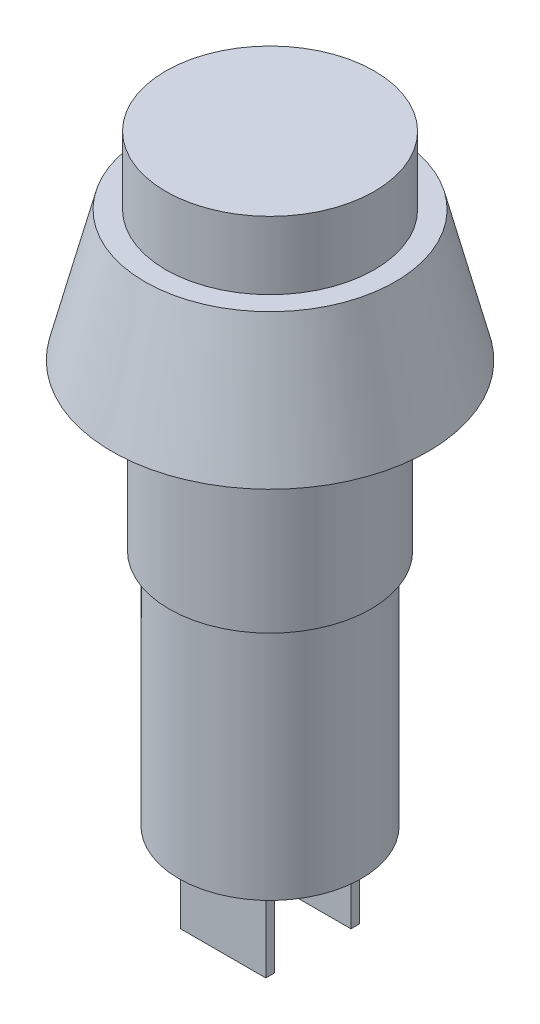
from build123d import *

# Parameters (mm, degrees)
SKETCH_6_R      = 6
EXTRUDE_3_DEPTH = 3.9
SKETCH_7_R      = 5.8
EXTRUDE_4_DEPTH = 9.5
SKETCH_8_R      = 5.25
EXTRUDE_5_DEPTH = 13.7
SKETCH_9_W      = 4.89861288
SKETCH_9_H      = 0.5003769
SKETCH_9_H_2    = 0.495607413
EXTRUDE_6_DEPTH = 5


with BuildPart() as part:
    # Эскиз5 → Повернуть1 (revolve)
    with BuildSketch(Plane.XY, mode=Mode.PRIVATE) as revolve_1_sk:
        Polygon((-7.2, 7.5), (-9.1, 0), (0, 0), (0, 7.5), align=None)
    revolve(revolve_1_sk.sketch.rotate(Axis((0, 0, 0), (0, 1, 0)), 270), axis=Axis((0, 0, 0), (0, 1, 0)))

    # Эскиз6 → Бобышка-Вытянуть3 (add)
    with BuildSketch(Plane(origin=(0, 7.5, 0), x_dir=(1, 0, 0), z_dir=(0, 1, 0))):
        with Locations(Location((0, 0, 0), (0, 0, 90))):
            Circle(SKETCH_6_R)
    extrude(amount=EXTRUDE_3_DEPTH)

    # Эскиз7 → Бобышка-Вытянуть4 (add)
    with BuildSketch(Plane.XZ):
        with Locations(Location((0, 0, 0), (0, 0, 90))):
            Circle(SKETCH_7_R)
    extrude(amount=EXTRUDE_4_DEPTH)

    # Эскиз8 → Бобышка-Вытянуть5 (add)
    with BuildSketch(Plane.XZ.offset(9.5)):
        with Locations(Location((0, 0, 0), (0, 0, 90))):
            Circle(SKETCH_8_R)
    extrude(amount=EXTRUDE_5_DEPTH)

    # Эскиз9 → Бобышка-Вытянуть6 (add)
    with BuildSketch(Plane(origin=(0, -23.2, 0), x_dir=(-1, 0, 0), z_dir=(0, -1, 0))):
        with Locations((-0.000422971, 2.45018845)):
            Rectangle(SKETCH_9_W, SKETCH_9_H)
        with Locations((-0.000422971, -2.447803707)):
            Rectangle(SKETCH_9_W, SKETCH_9_H_2)
    extrude(amount=EXTRUDE_6_DEPTH)


solid = part.part
